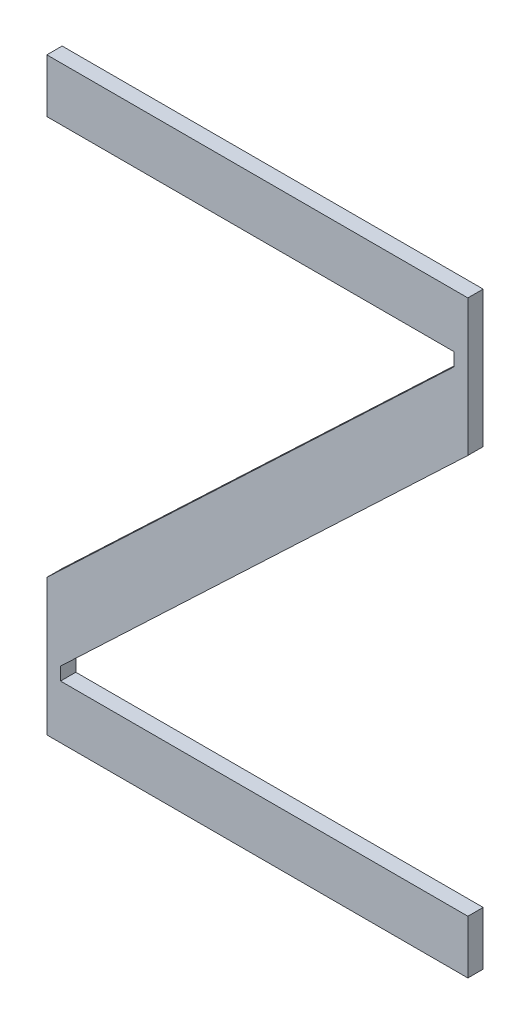
from build123d import *

# Parameters (mm, degrees)
BOSS_EXTRUDE1_DEPTH = 20


with BuildPart() as part:
    # Sketch1 → Boss-Extrude1 (new body)
    with BuildSketch(Plane.XY):
        Polygon((0, -70), (0, -178.59476288), (-533.095953507, -683.831602824), (-533.095953507, -700.8), (0, -700.8), (0, -770.8), (-551, -770.8), (-551, -700.8), (-551, -592.20523712), (-18.288256876, -87.332529071), (-18.288256876, -70), (-551, -70), (-551, 0), (0, 0), align=None)
    extrude(amount=BOSS_EXTRUDE1_DEPTH)


solid = part.part
